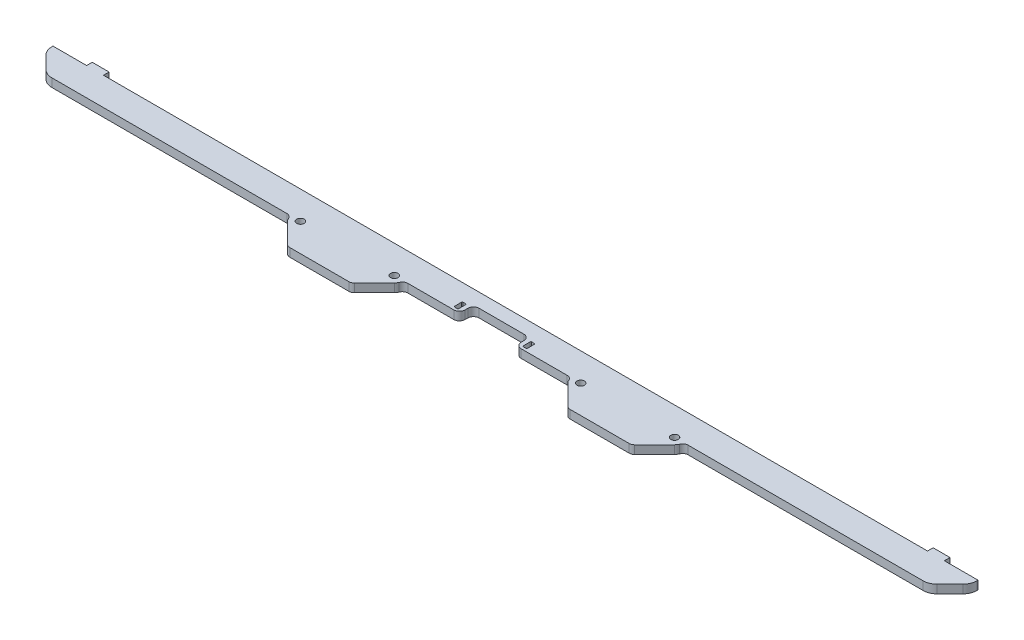
from build123d import *

# Parameters (mm, degrees)
SKETCH1_W           = 6
SKETCH1_H           = 2
BOSS_EXTRUDE1_DEPTH = 3
FILLET1_R           = 5
BOSS_EXTRUDE2_DEPTH = 3
CUT_EXTRUDE1_REACH  = 167.708
SKETCH3_R           = 1.325
SKETCH3_W           = 20
SKETCH3_H           = 5
FILLET2_R           = 2
FILLET3_R           = 2


with BuildPart() as part:
    # Sketch1 → Boss-Extrude1 (new body)
    with BuildSketch(Plane(origin=(0, 0, 0), x_dir=(1, 0, 0), z_dir=(0, 1, 0))):
        Polygon((-153, 5), (-165, 5), (-165, 2.5), (-157.5, -5), (157.5, -5), (165, 2.5), (165, 5), (153, 5), (147, 5), (-147, 5), align=None)
        with Locations((-150, 6)):
            Rectangle(SKETCH1_W, SKETCH1_H)
        with Locations((150, 6)):
            Rectangle(SKETCH1_W, SKETCH1_H)
    extrude(amount=BOSS_EXTRUDE1_DEPTH)

    # Fillet1
    fillet1_edges = [part.edges().sort_by_distance(p)[0] for p in [
        (157.5, 1.5, 5),
        (-157.5, 1.5, 5),
        (-165, 1.5, -2.5),
        (165, 1.5, -2.5),
    ]]
    fillet(fillet1_edges, radius=FILLET1_R)

    # Sketch2 → Boss-Extrude2 (add)
    with BuildSketch(Plane(origin=(0, 3, 0), x_dir=(1, 0, 0), z_dir=(0, 1, 0))):
        with BuildLine():
            Line((-38.653805922, -15), (-30.951902961, -7.298097039))
            ThreePointArc((-30.951902961, -7.298097039), (-34.493721155, -8.002608481), (-36.5, -5))
            Line((-36.5, -5), (-63.5, -5))
            ThreePointArc((-63.5, -5), (-65.506278845, -8.002608481), (-69.048097039, -7.298097039))
            Line((-69.048097039, -7.298097039), (-61.346194078, -15))
            Line((-61.346194078, -15), (-38.653805922, -15))
        make_face()
        with BuildLine():
            Line((-65.425, -5), (-63.5, -5))
            ThreePointArc((-63.5, -5), (-66.75, -1.75), (-70, -5))
            Line((-70, -5), (-68.075, -5))
            ThreePointArc((-68.075, -5), (-66.75, -3.675), (-65.425, -5))
        make_face()
        with BuildLine():
            ThreePointArc((-69.048097039, -7.298097039), (-65.506278845, -8.002608481), (-63.5, -5))
            Line((-63.5, -5), (-65.425, -5))
            ThreePointArc((-65.425, -5), (-66.75, -6.325), (-68.075, -5))
            Line((-68.075, -5), (-70, -5))
            ThreePointArc((-70, -5), (-69.752608481, -6.243721155), (-69.048097039, -7.298097039))
        make_face()
        with BuildLine():
            ThreePointArc((-30.951902961, -7.298097039), (-30.247391519, -6.243721155), (-30, -5))
            Line((-30, -5), (-31.925, -5))
            ThreePointArc((-31.925, -5), (-33.25, -6.325), (-34.575, -5))
            Line((-34.575, -5), (-36.5, -5))
            ThreePointArc((-36.5, -5), (-34.493721155, -8.002608481), (-30.951902961, -7.298097039))
        make_face()
        with BuildLine():
            Line((-31.925, -5), (-30, -5))
            ThreePointArc((-30, -5), (-33.25, -1.75), (-36.5, -5))
            Line((-36.5, -5), (-34.575, -5))
            ThreePointArc((-34.575, -5), (-33.25, -3.675), (-31.925, -5))
        make_face()
        with BuildLine():
            Line((61.346194078, -15), (69.048097039, -7.298097039))
            ThreePointArc((69.048097039, -7.298097039), (65.506278845, -8.002608481), (63.5, -5))
            Line((63.5, -5), (36.5, -5))
            ThreePointArc((36.5, -5), (34.493721155, -8.002608481), (30.951902961, -7.298097039))
            Line((30.951902961, -7.298097039), (38.653805922, -15))
            Line((38.653805922, -15), (61.346194078, -15))
        make_face()
        with BuildLine():
            Line((31.925, -5), (30, -5))
            ThreePointArc((30, -4.999999997), (30.247391519, -6.243721154), (30.951902961, -7.298097039))
            ThreePointArc((30.951902961, -7.298097039), (34.493721155, -8.002608481), (36.5, -5))
            Line((36.5, -5), (34.575, -5))
            ThreePointArc((34.575, -5), (33.25, -6.325), (31.925, -5))
        make_face()
        with BuildLine():
            ThreePointArc((36.5, -5), (33.250000002, -1.75), (30, -4.999999997))
            Line((30, -5), (31.925, -5))
            ThreePointArc((31.925, -5), (33.25, -3.675), (34.575, -5))
            Line((34.575, -5), (36.5, -5))
        make_face()
        with BuildLine():
            Line((68.075, -5), (70, -5))
            ThreePointArc((70, -5), (66.75, -1.75), (63.5, -5))
            Line((63.5, -5), (65.425, -5))
            ThreePointArc((65.425, -5), (66.75, -3.675), (68.075, -5))
        make_face()
        with BuildLine():
            ThreePointArc((69.048097039, -7.298097039), (69.752608481, -6.243721155), (70, -5))
            Line((70, -5), (68.075, -5))
            ThreePointArc((68.075, -5), (66.75, -6.325), (65.425, -5))
            Line((65.425, -5), (63.5, -5))
            ThreePointArc((63.5, -5), (65.506278845, -8.002608481), (69.048097039, -7.298097039))
        make_face()
    extrude(amount=-BOSS_EXTRUDE2_DEPTH)

    # Sketch3 → Cut-Extrude1 (cut, up to next)
    with BuildSketch(Plane(origin=(0, 3, 0), x_dir=(1, 0, 0), z_dir=(0, 1, 0)), mode=Mode.PRIVATE) as cut_extrude1_sk1:
        with Locations(Location((-66.75, -5, 0), (0, 0, 270))):
            Circle(SKETCH3_R)
    cut_extrude1_tool1 = extrude(cut_extrude1_sk1.sketch, amount=-CUT_EXTRUDE1_REACH, mode=Mode.PRIVATE) & part.part
    # Sketch3 → Cut-Extrude1 (cut, up to next)
    with BuildSketch(Plane(origin=(0, 3, 0), x_dir=(1, 0, 0), z_dir=(0, 1, 0)), mode=Mode.PRIVATE) as cut_extrude1_sk2:
        with Locations(Location((-33.25, -5, 0), (0, 0, 270))):
            Circle(SKETCH3_R)
    cut_extrude1_tool2 = extrude(cut_extrude1_sk2.sketch, amount=-CUT_EXTRUDE1_REACH, mode=Mode.PRIVATE) & part.part
    # Sketch3 → Cut-Extrude1 (cut, up to next)
    with BuildSketch(Plane(origin=(0, 3, 0), x_dir=(1, 0, 0), z_dir=(0, 1, 0)), mode=Mode.PRIVATE) as cut_extrude1_sk3:
        with Locations(Location((33.25, -5, 0), (0, 0, 270))):
            Circle(SKETCH3_R)
    cut_extrude1_tool3 = extrude(cut_extrude1_sk3.sketch, amount=-CUT_EXTRUDE1_REACH, mode=Mode.PRIVATE) & part.part
    # Sketch3 → Cut-Extrude1 (cut, up to next)
    with BuildSketch(Plane(origin=(0, 3, 0), x_dir=(1, 0, 0), z_dir=(0, 1, 0)), mode=Mode.PRIVATE) as cut_extrude1_sk4:
        with Locations(Location((66.75, -5, 0), (0, 0, 270))):
            Circle(SKETCH3_R)
    cut_extrude1_tool4 = extrude(cut_extrude1_sk4.sketch, amount=-CUT_EXTRUDE1_REACH, mode=Mode.PRIVATE) & part.part
    # Sketch3 → Cut-Extrude1 (cut, up to next)
    with BuildSketch(Plane(origin=(0, 3, 0), x_dir=(1, 0, 0), z_dir=(0, 1, 0)), mode=Mode.PRIVATE) as cut_extrude1_sk5:
        with Locations((0, -2.5)):
            Rectangle(SKETCH3_W, SKETCH3_H)
    cut_extrude1_tool5 = extrude(cut_extrude1_sk5.sketch, amount=-CUT_EXTRUDE1_REACH, mode=Mode.PRIVATE) & part.part
    # Sketch3 → Cut-Extrude1 (cut, up to next)
    with BuildSketch(Plane(origin=(0, 3, 0), x_dir=(1, 0, 0), z_dir=(0, 1, 0)), mode=Mode.PRIVATE) as cut_extrude1_sk6:
        with BuildLine():
            Line((13, -1.25), (13, -3.75))
            ThreePointArc((13, -3.75), (12.926776695, -3.926776695), (12.75, -4))
            Line((12.75, -4), (11.75, -4))
            ThreePointArc((11.75, -4), (11.573223305, -3.926776695), (11.5, -3.75))
            Line((11.5, -3.75), (11.5, -1.25))
            ThreePointArc((11.5, -1.25), (11.573223305, -1.073223305), (11.75, -1))
            Line((11.75, -1), (12.75, -1))
            ThreePointArc((12.75, -1), (12.926776695, -1.073223305), (13, -1.25))
        make_face()
    cut_extrude1_tool6 = extrude(cut_extrude1_sk6.sketch, amount=-CUT_EXTRUDE1_REACH, mode=Mode.PRIVATE) & part.part
    # Sketch3 → Cut-Extrude1 (cut, up to next)
    with BuildSketch(Plane(origin=(0, 3, 0), x_dir=(1, 0, 0), z_dir=(0, 1, 0)), mode=Mode.PRIVATE) as cut_extrude1_sk7:
        with BuildLine():
            Line((-12.75, -1), (-11.75, -1))
            ThreePointArc((-11.75, -1), (-11.573223305, -1.073223305), (-11.5, -1.25))
            Line((-11.5, -1.25), (-11.5, -3.75))
            ThreePointArc((-11.5, -3.75), (-11.573223305, -3.926776695), (-11.75, -4))
            Line((-11.75, -4), (-12.75, -4))
            ThreePointArc((-12.75, -4), (-12.926776695, -3.926776695), (-13, -3.75))
            Line((-13, -3.75), (-13, -1.25))
            ThreePointArc((-13, -1.25), (-12.926776695, -1.073223305), (-12.75, -1))
        make_face()
    cut_extrude1_tool7 = extrude(cut_extrude1_sk7.sketch, amount=-CUT_EXTRUDE1_REACH, mode=Mode.PRIVATE) & part.part
    add(cut_extrude1_tool1.solids().sort_by_distance((-66.75, 3, 5))[0], mode=Mode.SUBTRACT)
    add(cut_extrude1_tool2.solids().sort_by_distance((-33.25, 3, 5))[0], mode=Mode.SUBTRACT)
    add(cut_extrude1_tool3.solids().sort_by_distance((33.25, 3, 5))[0], mode=Mode.SUBTRACT)
    add(cut_extrude1_tool4.solids().sort_by_distance((66.75, 3, 5))[0], mode=Mode.SUBTRACT)
    add(cut_extrude1_tool5.solids().sort_by_distance((0, 3, 2.5))[0], mode=Mode.SUBTRACT)
    add(cut_extrude1_tool6.solids().sort_by_distance((12.25, 3, 2.5))[0], mode=Mode.SUBTRACT)
    add(cut_extrude1_tool7.solids().sort_by_distance((-12.25, 3, 2.5))[0], mode=Mode.SUBTRACT)

    # Fillet2
    fillet2_edges = [part.edges().sort_by_distance(p)[0] for p in [
        (-30, 1.5, 5),
        (-70, 1.5, 5),
        (-61.346194078, 1.5, 15),
        (-38.653805922, 1.5, 15),
        (61.346194078, 1.5, 15),
        (38.653805922, 1.5, 15),
        (30, 1.5, 5),
        (70, 1.5, 5),
    ]]
    fillet(fillet2_edges, radius=FILLET2_R)

    # Fillet3
    fillet3_edges = [part.edges().sort_by_distance(p)[0] for p in [
        (10, 1.5, 0),
        (10, 1.5, 5),
        (-10, 1.5, 5),
        (-10, 1.5, 0),
    ]]
    fillet(fillet3_edges, radius=FILLET3_R)


solid = part.part
